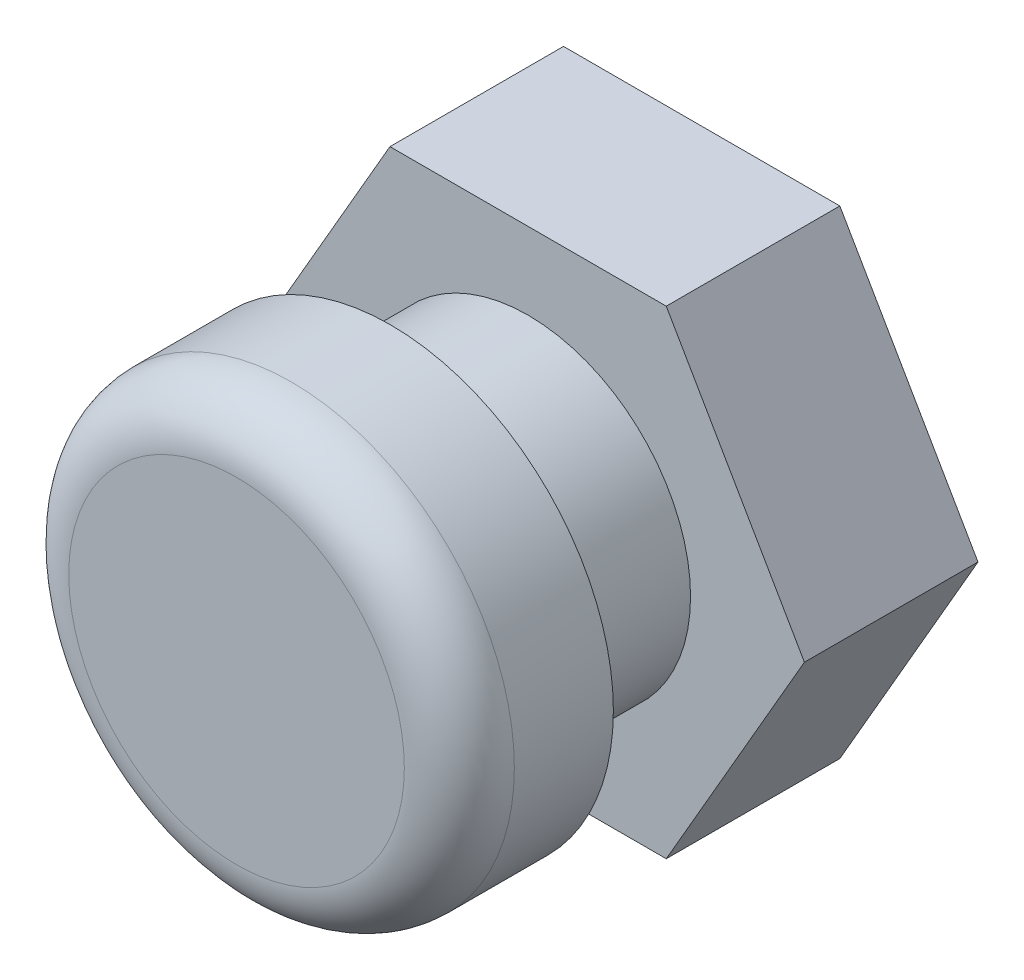
from build123d import *

# Parameters (mm, degrees)
SKETCH1_R      = 5.1435
EXTRUDE1_DEPTH = 3.556
SKETCH2_R      = 3.75
EXTRUDE2_DEPTH = 3.175
EXTRUDE3_DEPTH = 4.007423572
FILLET1_R      = 1.27


with BuildPart() as part:
    # Sketch1 → Extrude1 (new body)
    with BuildSketch(Plane.XY):
        Circle(SKETCH1_R)
    extrude(amount=EXTRUDE1_DEPTH)

    # Sketch2 → Extrude2 (add)
    with BuildSketch(Plane(origin=(0, 0, 0), x_dir=(-1, 0, 0), z_dir=(0, 0, -1))):
        with Locations(Location((0, 0, 0), (0, 0, 180))):
            Circle(SKETCH2_R)
    extrude(amount=EXTRUDE2_DEPTH)

    # Sketch3 → Extrude3 (add)
    with BuildSketch(Plane(origin=(0, 0, -3.175), x_dir=(-1, 0, 0), z_dir=(0, 0, -1))):
        Polygon((-3.189571562, -5.5245), (3.189571562, -5.5245), (6.379143124, 0), (3.189571562, 5.5245), (-3.189571562, 5.5245), (-6.379143124, 0), align=None)
    extrude(amount=EXTRUDE3_DEPTH)

    # Fillet1
    fillet1_edges = [part.edges().sort_by_distance(p)[0] for p in [
        (-5.1435, 0, 3.556),
    ]]
    fillet(fillet1_edges, radius=FILLET1_R)


solid = part.part
